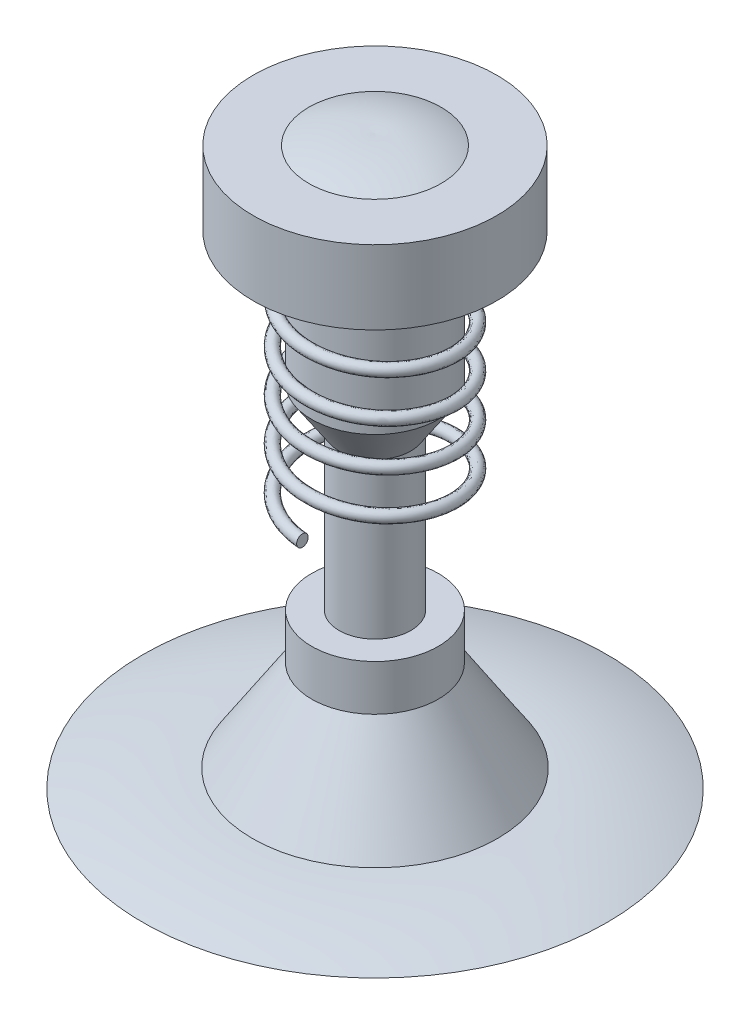
from build123d import *

# Parameters (mm, degrees)
SWEEP1_PITCH  = 0.2
SWEEP1_HEIGHT = 1.1
SWEEP1_RADIUS = 0.344
SKETCH3_R     = 0.0275


with BuildPart() as part:
    # Sketch1 → Revolve1 (revolve)
    with BuildSketch(Plane.XY, mode=Mode.PRIVATE) as revolve1_sk:
        with BuildLine():
            Line((-0.007597801, 1.698956893), (-0.007597801, -0.991043107))
            Line((-0.007597801, -0.991043107), (1.092402199, -0.991043107))
            ThreePointArc((1.092402199, -0.991043107), (0.836265768, -0.927583574), (0.573281721, -0.905849391))
            Line((0.573281721, -0.905849391), (0.292402199, -0.474424911))
            Line((0.292402199, -0.474424911), (0.292402199, -0.257666667))
            Line((0.292402199, -0.257666667), (0.162402199, -0.257666667))
            Line((0.162402199, -0.257666667), (0.162402199, 0.479252131))
            Line((0.162402199, 0.479252131), (0.292402199, 0.673956893))
            Line((0.292402199, 0.673956893), (0.292402199, 1.298956893))
            Line((0.292402199, 1.298956893), (0.56957225, 1.298956893))
            Line((0.56957225, 1.298956893), (0.56957225, 1.648956893))
            Line((0.56957225, 1.648956893), (0.305858425, 1.648956893))
            ThreePointArc((0.305858425, 1.648956893), (0.151961304, 1.691704731), (-0.007597801, 1.698956893))
        make_face()
    revolve(revolve1_sk.sketch.rotate(Axis((-0.007597801, 1.698956893, 0), (0, -1, 0)), 180), axis=Axis((-0.007597801, 1.698956893, 0), (0, -1, 0)))

    # Sweep1: sweep along a helix
    with BuildLine() as sweep1_path:
        Helix(SWEEP1_PITCH, SWEEP1_HEIGHT, SWEEP1_RADIUS, center=(-0.007597801, 1.298956893, 0), direction=(0, -1, 0), lefthand=True)
    # Sketch3 → Sweep1 (sweep)
    with BuildSketch(Plane.XY):
        with Locations((0.336402199, 0.748956893)):
            Circle(SKETCH3_R)
    sweep(path=sweep1_path.line, is_frenet=True)


solid = part.part
